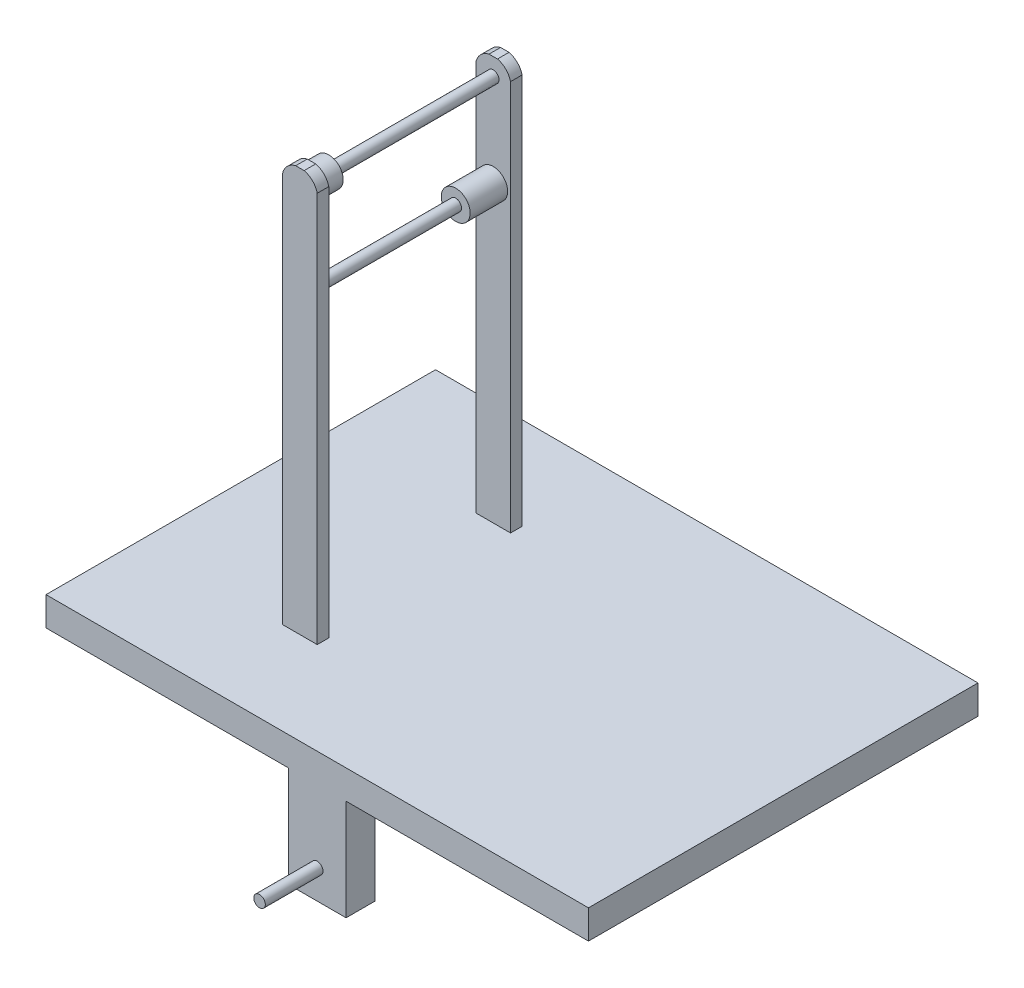
from build123d import *

# Parameters (mm, degrees)
ESQUISSE1_W             = 188
ESQUISSE1_H             = 135
BOSS_EXTRU_1_DEPTH      = 10
ESQUISSE2_W             = 12
ESQUISSE2_H             = 71
BOSS_EXTRU_2_DEPTH      = 140
ESQUISSE4_W             = 63
ESQUISSE4_H             = 140
ENL_V_MAT_EXTRU_1_DEPTH = 140
ESQUISSE6_R             = 2
BOSS_EXTRU_3_DEPTH      = 67
ENL_V_MAT_EXTRU_2_DEPTH = 262.635242274
ESQUISSE11_W            = 20
ESQUISSE11_H            = 10
BOSS_EXTRU_4_DEPTH      = 35
ESQUISSE12_R            = 2
BOSS_EXTRU_5_DEPTH      = 20
ESQUISSE13_W            = 20
ESQUISSE13_H            = 10
BOSS_EXTRU_6_DEPTH      = 35
BOSS_EXTRU_7_START      = 20
ESQUISSE14_R            = 2
BOSS_EXTRU_7_DEPTH      = 20
ESQUISSE15_R            = 2
BOSS_EXTRU_8_DEPTH      = 67
ESQUISSE16_R            = 5
BOSS_EXTRU_9_DEPTH      = 13
ESQUISSE17_R            = 5
BOSS_EXTRU_10_DEPTH     = 6


with BuildPart() as part:
    # Esquisse1 → Boss.-Extru.1 (new body)
    with BuildSketch(Plane(origin=(0, 0, 0), x_dir=(1, 0, 0), z_dir=(0, 1, 0))):
        with Locations((94, 67.5)):
            Rectangle(ESQUISSE1_W, ESQUISSE1_H)
    extrude(amount=BOSS_EXTRU_1_DEPTH)

    # Esquisse2 → Boss.-Extru.2 (add)
    with BuildSketch(Plane(origin=(0, 10, 0), x_dir=(1, 0, 0), z_dir=(0, 1, 0))):
        with Locations((56, 67.5)):
            Rectangle(ESQUISSE2_W, ESQUISSE2_H)
    extrude(amount=BOSS_EXTRU_2_DEPTH)

    # Esquisse4 → Enlèv. mat.-Extru.1 (cut)
    with BuildSketch(Plane(origin=(62, 0, 0), x_dir=(0, 0, -1), z_dir=(1, 0, 0))):
        with Locations((67.5, 80)):
            Rectangle(ESQUISSE4_W, ESQUISSE4_H)
    extrude(amount=-ENL_V_MAT_EXTRU_1_DEPTH, mode=Mode.SUBTRACT)

    # Esquisse6 → Boss.-Extru.3 (add)
    with BuildSketch(Plane.XY.offset(-99)):
        with Locations(Location((56, 144, 0), (0, 0, 90))):
            Circle(ESQUISSE6_R)
    extrude(amount=BOSS_EXTRU_3_DEPTH)

    # Esquisse7 → Enlèv. mat.-Extru.2 (cut, through all)
    with BuildSketch(Plane.XY.offset(-32)):
        with BuildLine():
            Line((50, 145.469087673), (50, 152.744377171))
            Line((50, 152.744377171), (62, 152.744377171))
            Line((62, 152.744377171), (62, 145.469087673))
            ThreePointArc((62, 145.469087673), (56, 150.177233895), (50, 145.469087673))
        make_face()
    extrude(amount=-ENL_V_MAT_EXTRU_2_DEPTH, mode=Mode.SUBTRACT)

    # Esquisse11 → Boss.-Extru.4 (add)
    with BuildSketch(Plane.XZ):
        with Locations((94, -5)):
            Rectangle(ESQUISSE11_W, ESQUISSE11_H)
    extrude(amount=BOSS_EXTRU_4_DEPTH)

    # Esquisse12 → Boss.-Extru.5 (add)
    with BuildSketch(Plane.XY):
        with Locations(Location((94, -25, 0), (0, 0, 180))):
            Circle(ESQUISSE12_R)
    extrude(amount=BOSS_EXTRU_5_DEPTH)

    # Esquisse13 → Boss.-Extru.6 (add)
    with BuildSketch(Plane.XZ):
        with Locations((94, -130)):
            Rectangle(ESQUISSE13_W, ESQUISSE13_H)
    extrude(amount=BOSS_EXTRU_6_DEPTH)

    # Esquisse14 → Boss.-Extru.7 (add)
    with BuildSketch(Plane(origin=(0, 0, -135), x_dir=(-1, 0, 0), z_dir=(0, 0, -1)).offset(BOSS_EXTRU_7_START)):
        with Locations((-94, -25)):
            Circle(ESQUISSE14_R)
    extrude(amount=-BOSS_EXTRU_7_DEPTH)

    # Esquisse15 → Boss.-Extru.8 (add)
    with BuildSketch(Plane.XY.offset(-99)):
        with Locations(Location((56, 112, 0), (0, 0, 90))):
            Circle(ESQUISSE15_R)
    extrude(amount=BOSS_EXTRU_8_DEPTH)

    # Esquisse16 → Boss.-Extru.9 (add)
    with BuildSketch(Plane.XY.offset(-99)):
        with Locations(Location((56, 112, 0), (0, 0, 180))):
            Circle(ESQUISSE16_R)
    extrude(amount=BOSS_EXTRU_9_DEPTH)

    # Esquisse17 → Boss.-Extru.10 (add)
    with BuildSketch(Plane(origin=(0, 0, -36), x_dir=(-1, 0, 0), z_dir=(0, 0, -1))):
        with Locations(Location((-56, 144, 0), (0, 0, 270))):
            Circle(ESQUISSE17_R)
    extrude(amount=BOSS_EXTRU_10_DEPTH)


solid = part.part
